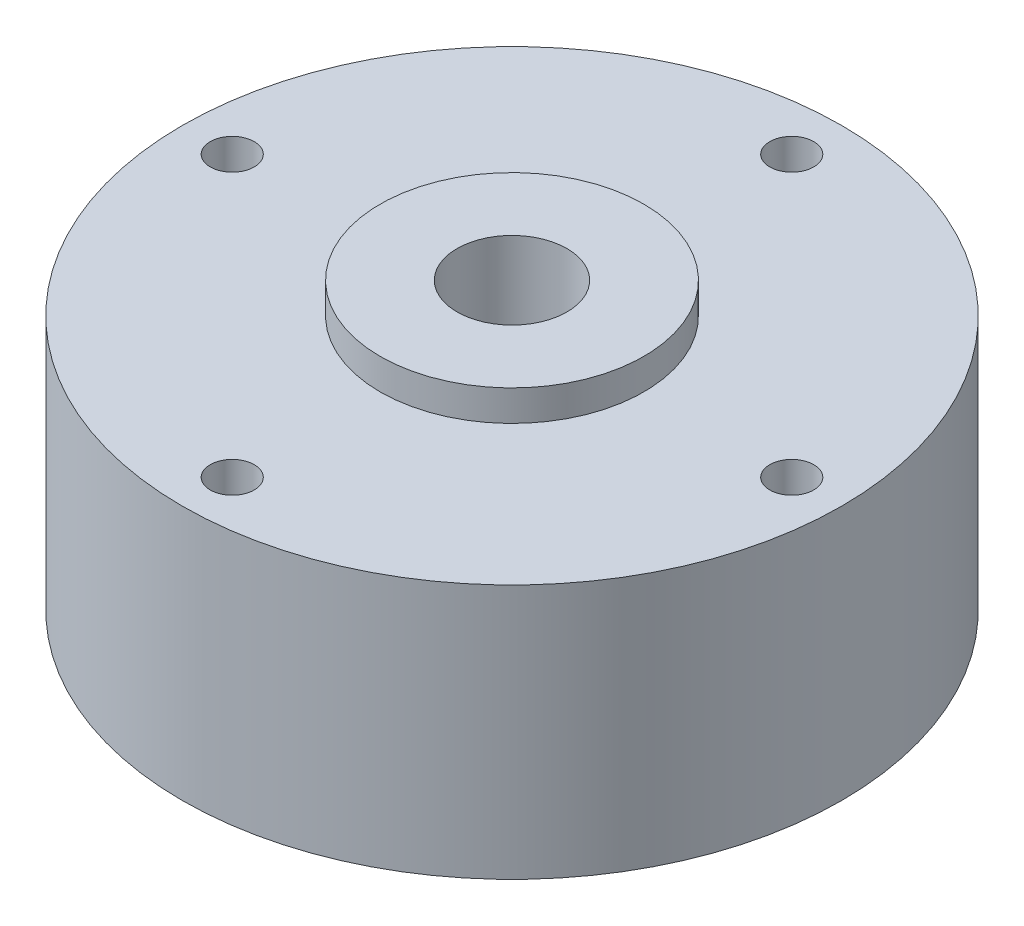
from build123d import *

# Parameters (mm, degrees)
SKETCH1_R      = 15
EXTRUDE1_DEPTH = 13
EXTRUDE2_START = -1.4
SKETCH2_R      = 15
SKETCH2_R_2    = 6
EXTRUDE2_DEPTH = 1.4
SKETCH3_R      = 1
EXTRUDE3_DEPTH = 4.4
SKETCH5_R      = 1
EXTRUDE5_DEPTH = 3
SKETCH6_R      = 2.5
EXTRUDE6_DEPTH = 25.879710609


with BuildPart() as part:
    # Sketch1 → Extrude1 (new body)
    with BuildSketch(Plane(origin=(0, 0, 0), x_dir=(1, 0, 0), z_dir=(0, 1, 0))):
        Circle(SKETCH1_R)
    extrude(amount=EXTRUDE1_DEPTH)

    # Sketch2 → Extrude2 (cut)
    with BuildSketch(Plane(origin=(0, 13, 0), x_dir=(1, 0, 0), z_dir=(0, 1, 0)).offset(EXTRUDE2_START)):
        Circle(SKETCH2_R)
        Circle(SKETCH2_R_2, mode=Mode.SUBTRACT)
    extrude(amount=EXTRUDE2_DEPTH, mode=Mode.SUBTRACT)

    # Sketch3 → Extrude3 (cut)
    with BuildSketch(Plane(origin=(0, 13, 0), x_dir=(1, 0, 0), z_dir=(0, 1, 0))):
        with Locations((0, 12.7279)):
            Circle(SKETCH3_R)
        with Locations((12.7279, 0)):
            Circle(SKETCH3_R)
        with Locations((0, -12.7279)):
            Circle(SKETCH3_R)
        with Locations((-12.7279, 0)):
            Circle(SKETCH3_R)
    extrude(amount=-EXTRUDE3_DEPTH, mode=Mode.SUBTRACT)

    # Sketch5 → Extrude5 (cut)
    with BuildSketch(Plane.XZ):
        with Locations((-11, 5)):
            Circle(SKETCH5_R)
        with Locations((11, 5)):
            Circle(SKETCH5_R)
        with Locations((11, -5)):
            Circle(SKETCH5_R)
        with Locations((-11, -5)):
            Circle(SKETCH5_R)
    extrude(amount=-EXTRUDE5_DEPTH, mode=Mode.SUBTRACT)

    # Sketch6 → Extrude6 (cut, through all)
    with BuildSketch(Plane.XZ):
        Circle(SKETCH6_R)
    extrude(amount=-EXTRUDE6_DEPTH, mode=Mode.SUBTRACT)


solid = part.part
